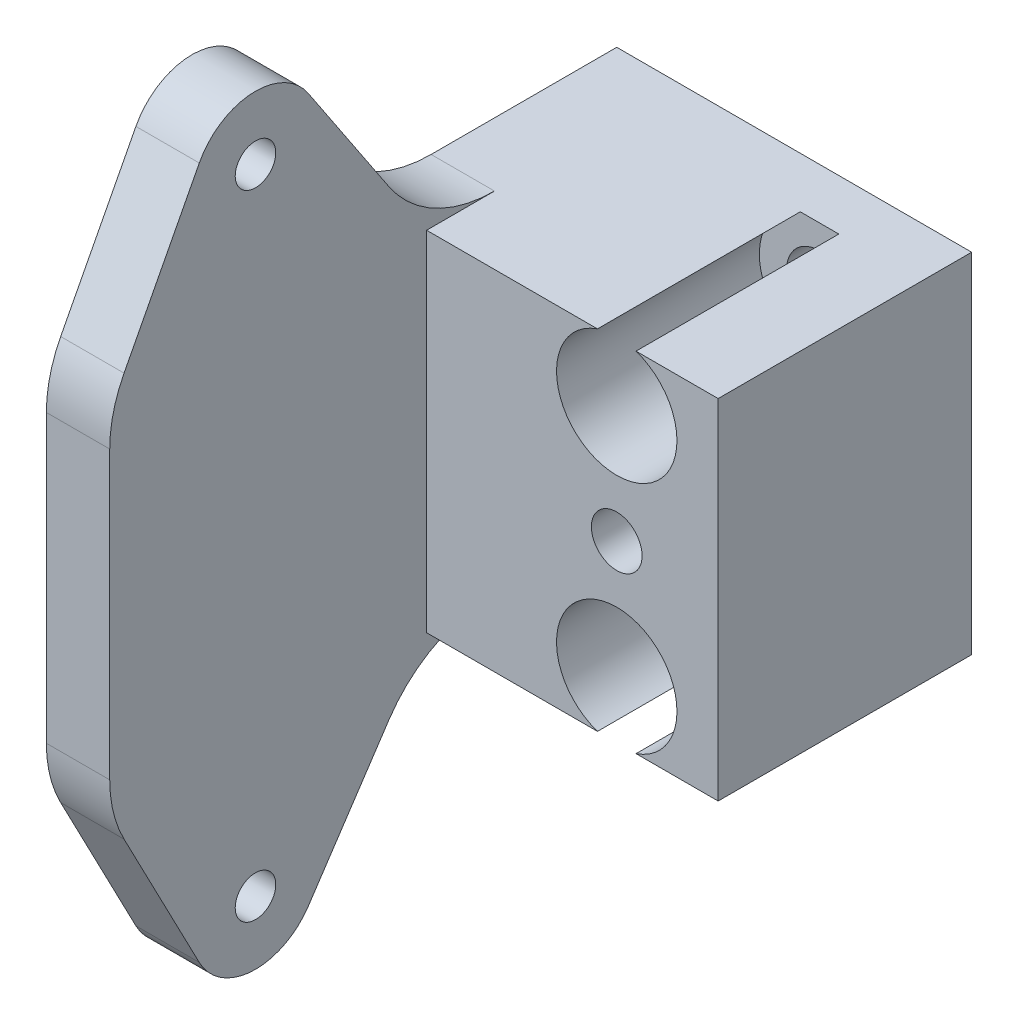
from build123d import *

# Parameters (mm, degrees)
SKETCH_1_W          = 23
SKETCH_1_H          = 27.5
SKETCH_1_R          = 2.6
SKETCH_1_R_2        = 2
EXTRUDE_1_DEPTH     = 20
SKETCH_3_R          = 4.75
CUT_EXTRUDE_3_DEPTH = 16
SKETCH_2_R          = 1.6
EXTRUDE_2_DEPTH     = 5
FILLET_1_R          = 10


with BuildPart() as part:
    # 草图1 → 凸台-拉伸1 (new body)
    with BuildSketch(Plane.XY):
        with Locations((-3.5, 0)):
            Rectangle(SKETCH_1_W, SKETCH_1_H)
        with Locations((0, 9.25)):
            Circle(SKETCH_1_R, mode=Mode.SUBTRACT)
        with Locations(Location((0, -9.25, 0), (0, 0, 180))):
            Circle(SKETCH_1_R, mode=Mode.SUBTRACT)
        Circle(SKETCH_1_R_2, mode=Mode.SUBTRACT)
    extrude(amount=EXTRUDE_1_DEPTH)

    # 草图3 → 切除-拉伸3 (cut)
    with BuildSketch(Plane.XY.offset(20)):
        with Locations((0, 9.25)):
            Circle(SKETCH_3_R)
        with Locations((0, -9.25)):
            Circle(SKETCH_3_R)
    extrude(amount=-CUT_EXTRUDE_3_DEPTH, mode=Mode.SUBTRACT)

    # 草图2 → 凸台-拉伸2 (add)
    with BuildSketch(Plane.ZY.offset(15)):
        with BuildLine():
            Line((0, 13.75), (20, 13.75))
            Line((20, 13.75), (29.338481678, 27.771599764))
            ThreePointArc((29.338481678, 27.771599764), (33.767848759, 29.99282055), (37.93415499, 27.310469546))
            Line((37.93415499, 27.310469546), (45, 13.75))
            Line((45, 13.75), (45, -13.75))
            Line((45, -13.75), (37.93415499, -27.310469546))
            ThreePointArc((37.93415499, -27.310469546), (33.767848759, -29.99282055), (29.338481678, -27.771599764))
            Line((29.338481678, -27.771599764), (20, -13.75))
            Line((20, -13.75), (0, -13.75))
            Line((0, -13.75), (0, 13.75))
        make_face()
        with Locations((33.5, 25)):
            Circle(SKETCH_2_R, mode=Mode.SUBTRACT)
        with Locations((33.5, -25)):
            Circle(SKETCH_2_R, mode=Mode.SUBTRACT)
    extrude(amount=EXTRUDE_2_DEPTH)

    # 圆角1
    fillet_1_edges = [part.edges().sort_by_distance(p)[0] for p in [
        (-17.5, -13.75, 20),
        (-17.5, -13.75, 45),
        (-17.5, 13.75, 45),
        (-17.5, 13.75, 20),
    ]]
    fillet(fillet_1_edges, radius=FILLET_1_R)


solid = part.part
